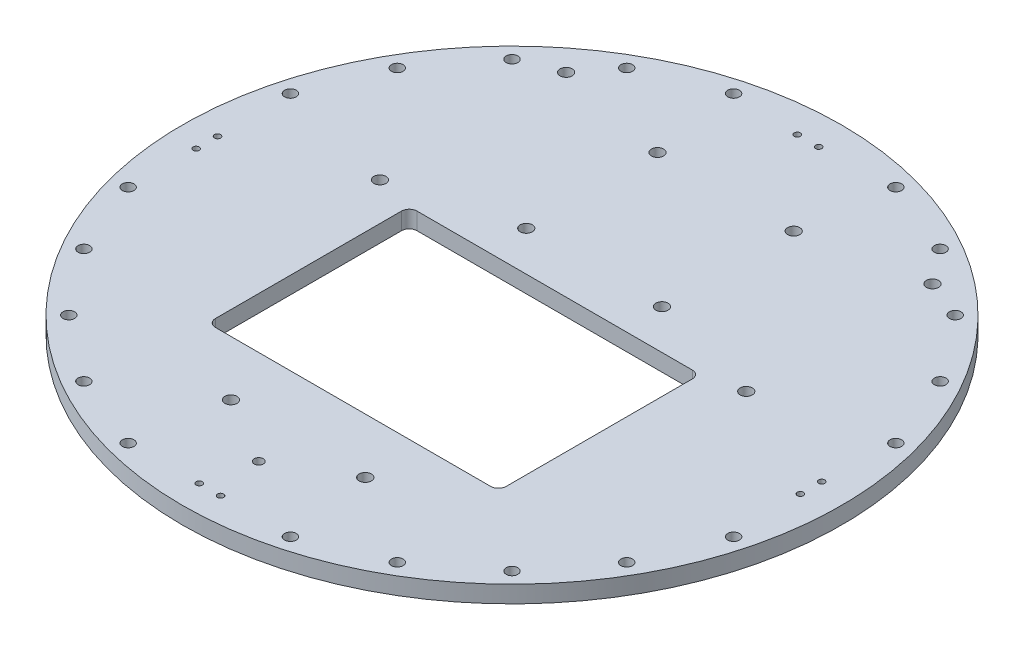
from build123d import *

# Parameters (mm, degrees)
ESQUISSE1_R             = 107.95
BOSS_EXTRU_1_DEPTH      = 5.588
ESQUISSE2_R             = 1.905
ENL_V_MAT_EXTRU_1_DEPTH = 5.588
ENL_V_MAT_EXTRU_2_DEPTH = 5.588
ESQUISSE5_R             = 1
ENL_V_MAT_EXTRU_3_DEPTH = 153.766589096
ESQUISSE6_R             = 2
ENL_V_MAT_EXTRU_4_DEPTH = 153.766589096
ESQUISSE8_R             = 1.5
ENL_V_MAT_EXTRU_6_DEPTH = 153.766589096
ESQUISSE10_R            = 2
ENL_V_MAT_EXTRU_7_DEPTH = 153.766589096


with BuildPart() as part:
    # Esquisse1 → Boss.-Extru.1 (new body)
    with BuildSketch(Plane(origin=(0, 0, 0), x_dir=(1, 0, 0), z_dir=(0, 1, 0))):
        with Locations(Location((0, 0, 0), (0, 0, 270))):
            Circle(ESQUISSE1_R)
    extrude(amount=BOSS_EXTRU_1_DEPTH)

    # Esquisse2 → Enlèv. mat.-Extru.1 (cut)
    with BuildSketch(Plane(origin=(0, 5.588, 0), x_dir=(1, 0, 0), z_dir=(0, 1, 0))):
        with Locations(Location((26.569931805, 99.16033545, 0), (0, 0, 270))):
            Circle(ESQUISSE2_R)
        with Locations(Location((51.329166667, 88.904724577, 0), (0, 0, 270))):
            Circle(ESQUISSE2_R)
        with Locations(Location((72.590403645, 72.590403645, 0), (0, 0, 270))):
            Circle(ESQUISSE2_R)
        with Locations(Location((88.904724577, 51.329166667, 0), (0, 0, 270))):
            Circle(ESQUISSE2_R)
        with Locations(Location((99.16033545, 26.569931805, 0), (0, 0, 270))):
            Circle(ESQUISSE2_R)
        with Locations(Location((99.16033545, -26.569931805, 0), (0, 0, 270))):
            Circle(ESQUISSE2_R)
        with Locations(Location((88.904724577, -51.329166667, 0), (0, 0, 270))):
            Circle(ESQUISSE2_R)
        with Locations(Location((72.590403645, -72.590403645, 0), (0, 0, 270))):
            Circle(ESQUISSE2_R)
        with Locations(Location((51.329166667, -88.904724577, 0), (0, 0, 270))):
            Circle(ESQUISSE2_R)
        with Locations(Location((26.569931805, -99.16033545, 0), (0, 0, 270))):
            Circle(ESQUISSE2_R)
        with Locations(Location((-26.569931805, -99.16033545, 0), (0, 0, 270))):
            Circle(ESQUISSE2_R)
        with Locations(Location((-51.329166667, -88.904724577, 0), (0, 0, 270))):
            Circle(ESQUISSE2_R)
        with Locations(Location((-72.590403645, -72.590403645, 0), (0, 0, 270))):
            Circle(ESQUISSE2_R)
        with Locations(Location((-88.904724577, -51.329166667, 0), (0, 0, 270))):
            Circle(ESQUISSE2_R)
        with Locations(Location((-99.16033545, -26.569931805, 0), (0, 0, 270))):
            Circle(ESQUISSE2_R)
        with Locations(Location((-99.16033545, 26.569931805, 0), (0, 0, 270))):
            Circle(ESQUISSE2_R)
        with Locations(Location((-88.904724577, 51.329166667, 0), (0, 0, 270))):
            Circle(ESQUISSE2_R)
        with Locations(Location((-72.590403645, 72.590403645, 0), (0, 0, 270))):
            Circle(ESQUISSE2_R)
        with Locations(Location((-51.329166667, 88.904724577, 0), (0, 0, 270))):
            Circle(ESQUISSE2_R)
        with Locations(Location((-26.569931805, 99.16033545, 0), (0, 0, 270))):
            Circle(ESQUISSE2_R)
    extrude(amount=-ENL_V_MAT_EXTRU_1_DEPTH, mode=Mode.SUBTRACT)

    # Esquisse3 → Enlèv. mat.-Extru.2 (cut)
    with BuildSketch(Plane(origin=(0, 5.588, 0), x_dir=(1, 0, 0), z_dir=(0, 1, 0))):
        with BuildLine():
            Line((-45.085, -52.07), (45.085, -52.07))
            ThreePointArc((45.085, -52.07), (46.881051224, -51.326051224), (47.625, -49.53))
            Line((47.625, -49.53), (47.625, 11.43))
            ThreePointArc((47.625, 11.43), (46.881051224, 13.226051224), (45.085, 13.97))
            Line((45.085, 13.97), (-45.085, 13.97))
            ThreePointArc((-45.085, 13.97), (-46.881051224, 13.226051224), (-47.625, 11.43))
            Line((-47.625, 11.43), (-47.625, -49.53))
            ThreePointArc((-47.625, -49.53), (-46.881051224, -51.326051224), (-45.085, -52.07))
        make_face()
    extrude(amount=-ENL_V_MAT_EXTRU_2_DEPTH, mode=Mode.SUBTRACT)

    # Esquisse5 → Enlèv. mat.-Extru.3 (cut, through all)
    with BuildSketch(Plane(origin=(0, 5.588, 0), x_dir=(1, 0, 0), z_dir=(0, 1, 0))):
        with Locations(Location((-3.5, -98.95, 0), (0, 0, 270))):
            Circle(ESQUISSE5_R)
        with Locations(Location((3.5, -98.95, 0), (0, 0, 90))):
            Circle(ESQUISSE5_R)
        with Locations(Location((-98.95, 2.5, 0), (0, 0, 270))):
            Circle(ESQUISSE5_R)
        with Locations(Location((-98.95, -4.5, 0), (0, 0, 90))):
            Circle(ESQUISSE5_R)
        with Locations(Location((2.5, 97.95, 0), (0, 0, 270))):
            Circle(ESQUISSE5_R)
        with Locations(Location((-4.5, 97.95, 0), (0, 0, 90))):
            Circle(ESQUISSE5_R)
        with Locations(Location((97.95, -3.5, 0), (0, 0, 270))):
            Circle(ESQUISSE5_R)
        with Locations(Location((97.95, 3.5, 0), (0, 0, 90))):
            Circle(ESQUISSE5_R)
    extrude(amount=-ENL_V_MAT_EXTRU_3_DEPTH, mode=Mode.SUBTRACT)

    # Esquisse6 → Enlèv. mat.-Extru.4 (cut, through all)
    with BuildSketch(Plane(origin=(0, 5.588, 0), x_dir=(1, 0, 0), z_dir=(0, 1, 0))):
        with Locations(Location((-22, -70.07, 0), (0, 0, 270))):
            Circle(ESQUISSE6_R)
        with Locations(Location((22, -70.07, 0), (0, 0, 270))):
            Circle(ESQUISSE6_R)
        with Locations(Location((-22.3, 69.97, 0), (0, 0, 270))):
            Circle(ESQUISSE6_R)
        with Locations(Location((22.3, 69.97, 0), (0, 0, 90))):
            Circle(ESQUISSE6_R)
        with Locations(Location((-22.3, 26.97, 0), (0, 0, 270))):
            Circle(ESQUISSE6_R)
        with Locations(Location((22.15, 26.97, 0), (0, 0, 270))):
            Circle(ESQUISSE6_R)
    extrude(amount=-ENL_V_MAT_EXTRU_4_DEPTH, mode=Mode.SUBTRACT)

    # Esquisse8 → Enlèv. mat.-Extru.6 (cut, through all)
    with BuildSketch(Plane(origin=(0, 5.588, 0), x_dir=(1, 0, 0), z_dir=(0, 1, 0))):
        with Locations(Location((0, -82.95, 0), (0, 0, 270))):
            Circle(ESQUISSE8_R)
    extrude(amount=-ENL_V_MAT_EXTRU_6_DEPTH, mode=Mode.SUBTRACT)

    # Esquisse10 → Enlèv. mat.-Extru.7 (cut, through all)
    with BuildSketch(Plane(origin=(0, 5.588, 0), x_dir=(1, 0, 0), z_dir=(0, 1, 0))):
        with Locations(Location((-60, 16.73, 0), (0, 0, 270))):
            Circle(ESQUISSE10_R)
        with Locations(Location((60, 16.73, 0), (0, 0, 90))):
            Circle(ESQUISSE10_R)
        with Locations(Location((-60, 77.73, 0), (0, 0, 270))):
            Circle(ESQUISSE10_R)
        with Locations(Location((60, 77.73, 0), (0, 0, 90))):
            Circle(ESQUISSE10_R)
    extrude(amount=-ENL_V_MAT_EXTRU_7_DEPTH, mode=Mode.SUBTRACT)


solid = part.part
